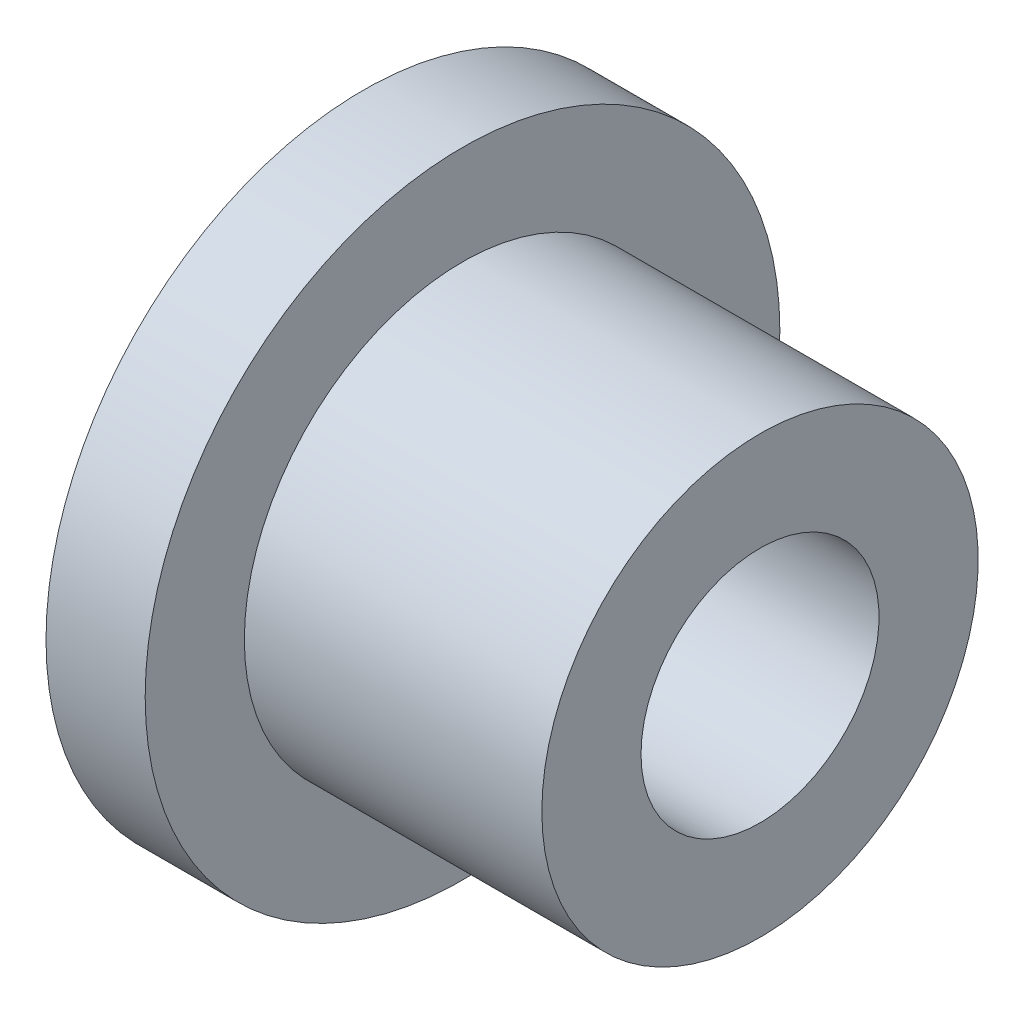
from build123d import *


with BuildPart() as part:
    # Sketch1 → Revolve1 (revolve)
    with BuildSketch(Plane.XY, mode=Mode.PRIVATE) as revolve1_sk:
        Polygon((0, 6), (0, 16), (5, 16), (5, 11), (20, 11), (20, 6), align=None)
    revolve(revolve1_sk.sketch.rotate(Axis((-20, 0, 0), (1, 0, 0)), 90), axis=Axis((-20, 0, 0), (1, 0, 0)))


solid = part.part
